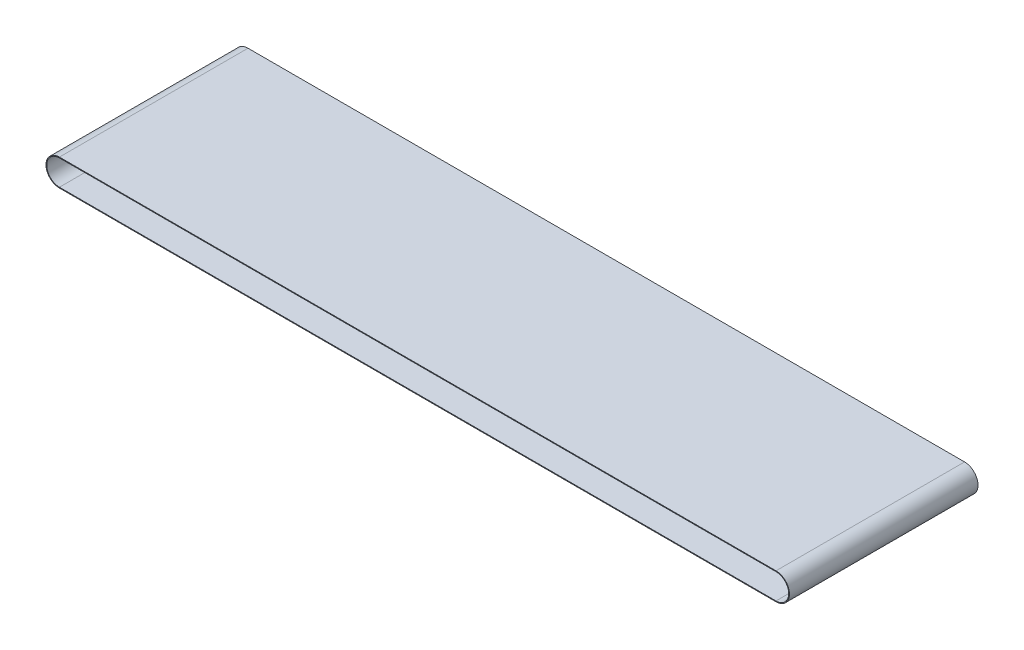
from build123d import *

# Parameters (mm, degrees)
EXTRUDE_THIN1_START = -5
EXTRUDE_THIN1_DEPTH = 250


with BuildPart() as part:
    # Sketch2 → Extrude-Thin1 (new body)
    with BuildSketch(Plane.XY.offset(EXTRUDE_THIN1_START)):
        with BuildLine():
            Line((950, -17.8), (0, -17.8))
            ThreePointArc((0, -17.8), (-17.8, 0), (0, 17.8))
            Line((0, 17.8), (950, 17.8))
            ThreePointArc((950, 17.8), (967.8, 0), (950, -17.8))
        make_face()
        with BuildLine():
            Line((950, -16.8), (0, -16.8))
            ThreePointArc((0, -16.8), (-16.8, 0), (0, 16.8))
            Line((0, 16.8), (950, 16.8))
            ThreePointArc((950, 16.8), (966.8, 0), (950, -16.8))
        make_face(mode=Mode.SUBTRACT)
    extrude(amount=-EXTRUDE_THIN1_DEPTH)


solid = part.part
